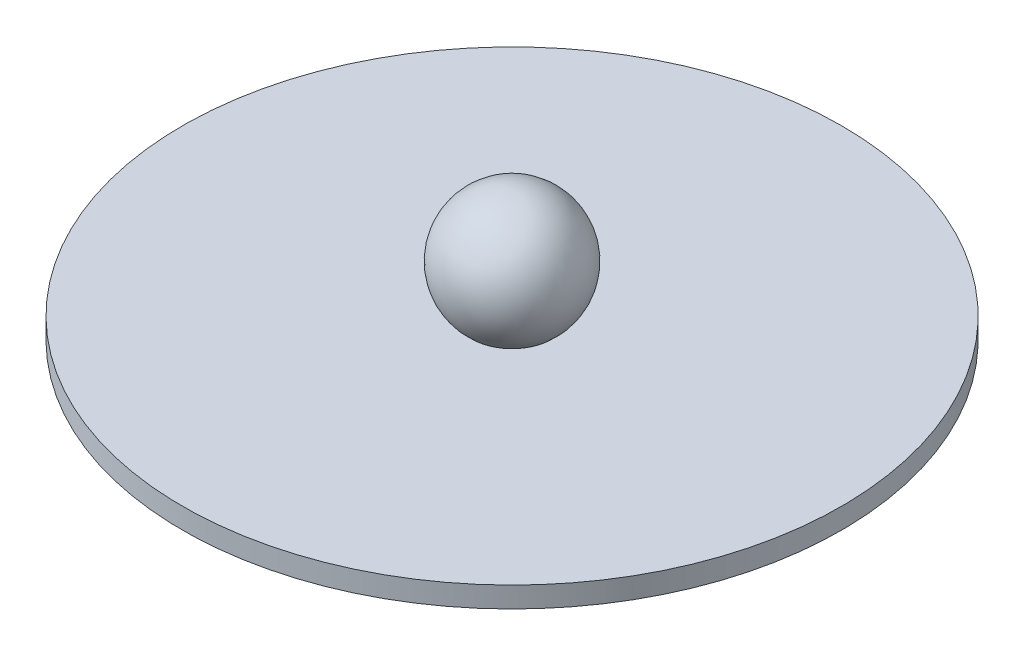
from build123d import *


with BuildPart() as part:
    # Sketch1 → Revolve1 (revolve)
    with BuildSketch(Plane.XY, mode=Mode.PRIVATE) as revolve1_sk:
        Polygon((100.965, 12.7), (100.965, 6.35), (95.885, 6.35), (89.535, 0), (0, 0), (0, 12.7), align=None)
    revolve(revolve1_sk.sketch.rotate(Axis((0, 0, 0), (0, 1, 0)), 90), axis=Axis((0, 0, 0), (0, 1, 0)))

    # Sketch2 → Revolve2 (revolve)
    with BuildSketch(Plane.XY):
        with BuildLine():
            Line((0, 46.314295443), (0, 8.214295443))
            ThreePointArc((0, 8.214295443), (19.05, 27.264295443), (0, 46.314295443))
        make_face()
    revolve(axis=Axis((0, 0, 0), (0, 1, 0)))


solid = part.part
